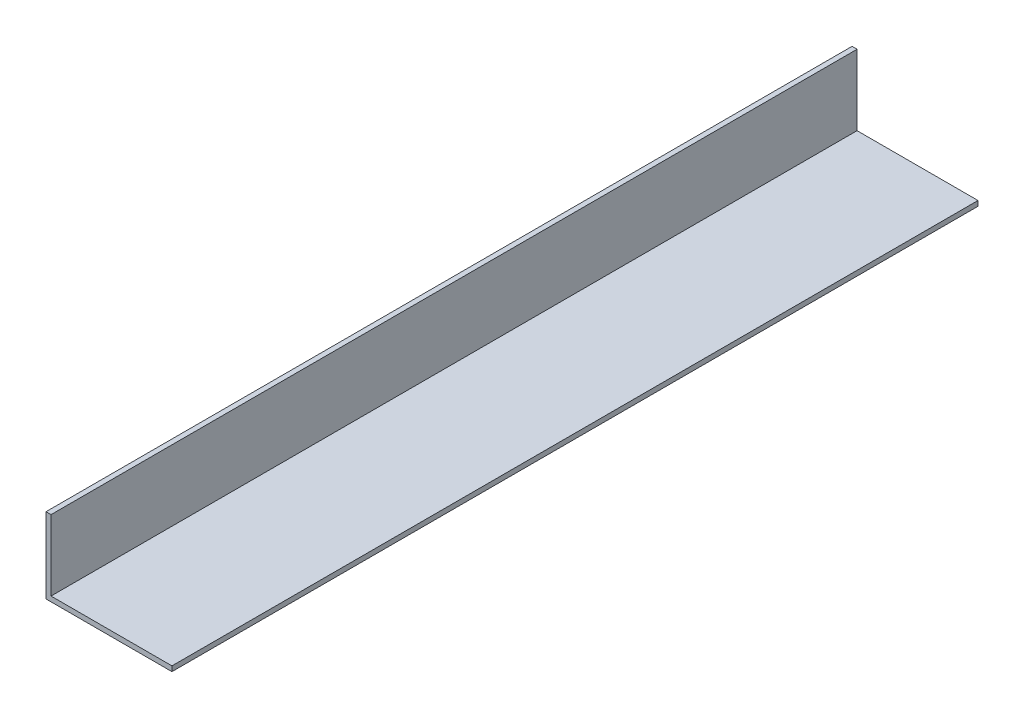
from build123d import *

# Parameters (mm, degrees)
BOSS_EXTRUDE1_DEPTH = 320


with BuildPart() as part:
    # Sketch1 → Boss-Extrude1 (new body)
    with BuildSketch(Plane.XY):
        Polygon((0, 0), (0, 30), (2, 30), (2, 2), (50, 2), (50, 0), align=None)
    extrude(amount=BOSS_EXTRUDE1_DEPTH)


solid = part.part
